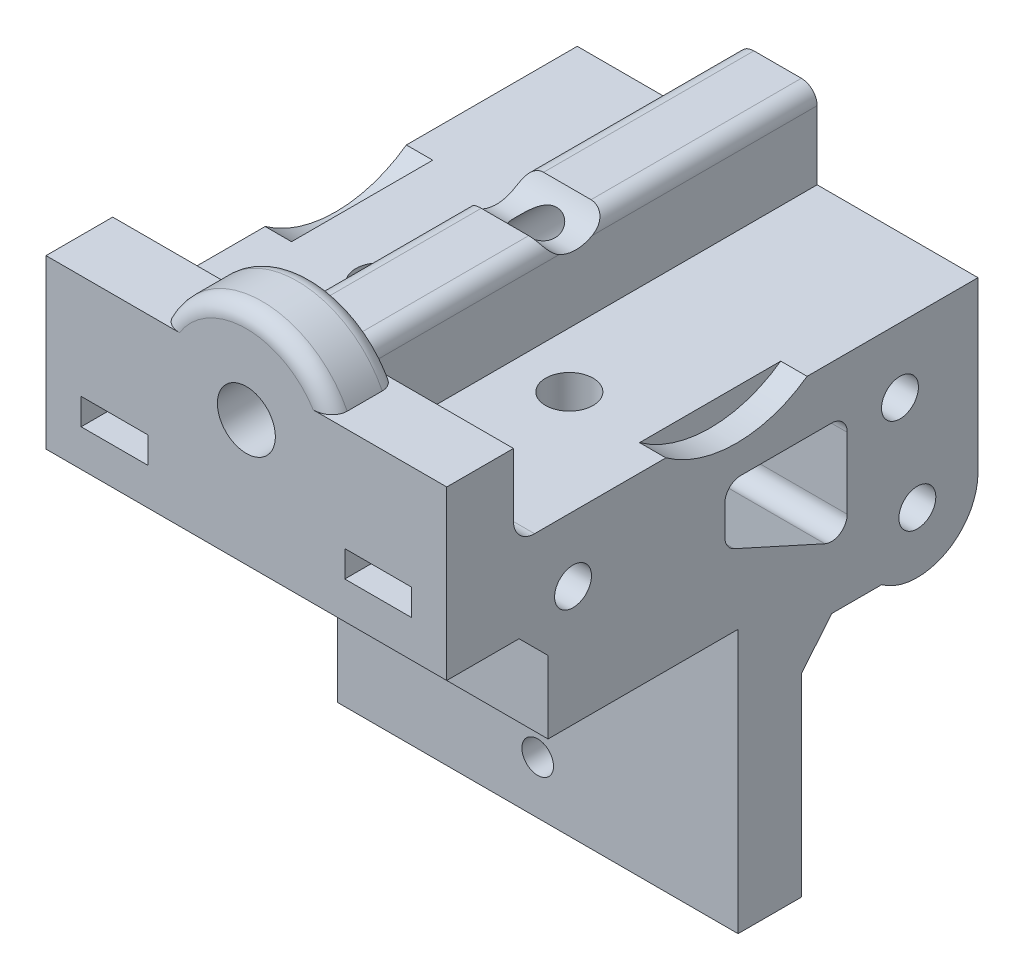
from build123d import *

# Parameters (mm, degrees)
BOSS_EXTRUDE5_DEPTH = 19
BOSS_EXTRUDE6_DEPTH = 8
BOSS_EXTRUDE7_DEPTH = 6.325904881
SKETCH11_R          = 1.75
CUT_MOTOR_DEPTH     = 19
SKETCH12_R          = 1.5
CUT_EXTRUDE7_DEPTH  = 46.325937613
SKETCH13_R          = 2.25
CUT_EXTRUDE8_DEPTH  = 46.216453805
SKETCH14_R          = 5.5
CUT_EXTRUDE9_DEPTH  = 4
SKETCH16_R          = 11.5
CUT_MOTOR_L_DEPTH   = 2.5
CUT_MOTOR_R_START   = -2.5
SKETCH15_R          = 11.5
CUT_MOTOR_R_DEPTH   = 2.5
SKETCH19_R          = 3.25
CUT_EXTRUDE10_DEPTH = 8
SKETCH20_R          = 2.75
CUT_EXTRUDE11_DEPTH = 62.878766896
CUT_EXTRUDE12_DEPTH = 56.924303306
FILLET1_R           = 2
FILLET2_R           = 1.5
FILLET3_R           = 1.5
SKETCH24_R          = 1.75
CUT_EXTRUDE14_DEPTH = 6
CUT_EXTRUDE15_DEPTH = 2.5


with BuildPart() as part:
    # Sketch10 → Boss-Extrude5 (new, symmetric)
    with BuildSketch(Plane(origin=(0, 0, 0), x_dir=(0, 0, -1), z_dir=(1, 0, 0))):
        with BuildLine():
            Line((-27.445904881, 9.607875665), (-20.588029216, 9.607875665))
            Line((-20.588029216, 9.607875665), (-17.838029216, 6.857875665))
            Line((-17.838029216, 6.857875665), (-17.838029216, 0))
            Line((-17.838029216, 0), (0.18, 0))
            Line((0.18, 0), (0.18, -25))
            Line((0.18, -25), (6.18, -25))
            Line((6.18, -25), (6.18, -6.648603252))
            Line((6.18, -6.648603252), (9.067622319, -3.148603252))
            Line((9.067622319, -3.148603252), (13.795773677, -3.148603252))
            ThreePointArc((13.795773677, -3.148603252), (19.7879876, -3.62453907), (22.93, 1.5))
            Line((22.93, 1.5), (22.93, 17.5))
            Line((22.93, 17.5), (-21.12, 17.5))
            Line((-21.12, 17.5), (-21.12, 25.5))
            Line((-21.12, 25.5), (-27.445904881, 25.5))
            Line((-27.445904881, 25.5), (-27.445904881, 9.607875665))
        make_face()
    extrude(amount=BOSS_EXTRUDE5_DEPTH, both=True)

    # Sketch18 → Boss-Extrude6 (add)
    with BuildSketch(Plane(origin=(0, 17.5, 0), x_dir=(1, 0, 0), z_dir=(0, 1, 0))):
        Polygon((-3.75, 22.93), (3.75, 22.93), (3.75, -21.12), (-3.75, -21.12), (-3.75, 14.93), align=None)
    extrude(amount=BOSS_EXTRUDE6_DEPTH)

    # Sketch21 → Boss-Extrude7 (add)
    with BuildSketch(Plane(origin=(0, 0, 27.445904881), x_dir=(-1, 0, 0), z_dir=(0, 0, -1))):
        with BuildLine():
            Line((8.062257748, 25.5), (-8.062257748, 25.5))
            ThreePointArc((-8.062257748, 25.5), (0, 30.5), (8.062257748, 25.5))
        make_face()
    extrude(amount=BOSS_EXTRUDE7_DEPTH)

    # Sketch11 → Cut-Motor (cut, symmetric)
    with BuildSketch(Plane(origin=(0, 0, 0), x_dir=(0, 0, -1), z_dir=(1, 0, 0))):
        with Locations((-15.47, 11.35)):
            Circle(SKETCH11_R)
        with Locations((15.53, 11.35)):
            Circle(SKETCH11_R)
        with Locations((17.18, 1.5)):
            Circle(SKETCH11_R)
    extrude(amount=CUT_MOTOR_DEPTH, both=True, mode=Mode.SUBTRACT)

    # Sketch12 → Cut-Extrude7 (cut, through all)
    with BuildSketch(Plane.XY.offset(-0.18)):
        with Locations((0, -20)):
            Circle(SKETCH12_R)
        with Locations((4.5, -10)):
            Circle(SKETCH12_R)
        with Locations((-4.5, -10)):
            Circle(SKETCH12_R)
    extrude(amount=-CUT_EXTRUDE7_DEPTH, mode=Mode.SUBTRACT)

    # Sketch13 → Cut-Extrude8 (cut, through all)
    with BuildSketch(Plane.XZ):
        with Locations(Location((-9, 5.82, 0), (0, 0, 270))):
            Circle(SKETCH13_R)
        with Locations(Location((9, 5.82, 0), (0, 0, 270))):
            Circle(SKETCH13_R)
    extrude(amount=-CUT_EXTRUDE8_DEPTH, mode=Mode.SUBTRACT)

    # Sketch14 → Cut-Extrude9 (cut)
    with BuildSketch(Plane.XZ):
        with Locations(Location((9, 5.82, 0), (0, 0, 270))):
            Circle(SKETCH14_R)
        with Locations(Location((-9, 5.82, 0), (0, 0, 270))):
            Circle(SKETCH14_R)
    extrude(amount=-CUT_EXTRUDE9_DEPTH, mode=Mode.SUBTRACT)

    # Sketch16 → Cut-Motor-L (cut)
    with BuildSketch(Plane.ZY.offset(19)):
        with Locations((-0.03, 26.85)):
            Circle(SKETCH16_R)
    extrude(amount=-CUT_MOTOR_L_DEPTH, mode=Mode.SUBTRACT)

    # Sketch15 → Cut-Motor-R (cut)
    with BuildSketch(Plane(origin=(19, 0, 0), x_dir=(0, 0, -1), z_dir=(1, 0, 0)).offset(CUT_MOTOR_R_START)):
        with Locations((0.03, 26.85)):
            Circle(SKETCH15_R)
    extrude(amount=CUT_MOTOR_R_DEPTH, mode=Mode.SUBTRACT)

    # Sketch19 → Cut-Extrude10 (cut)
    with BuildSketch(Plane(origin=(3.75, 0, 0), x_dir=(0, 0, -1), z_dir=(1, 0, 0))):
        with Locations((0.03, 26.85)):
            Circle(SKETCH19_R)
    extrude(amount=-CUT_EXTRUDE10_DEPTH, mode=Mode.SUBTRACT)

    # Sketch20 → Cut-Extrude11 (cut, through all)
    with BuildSketch(Plane.XY.offset(-22.93)):
        with Locations((0, 21.5)):
            Circle(SKETCH20_R)
    extrude(amount=CUT_EXTRUDE11_DEPTH, mode=Mode.SUBTRACT)

    # Sketch22 → Cut-Extrude12 (cut, through all)
    with BuildSketch(Plane(origin=(19, 0, 0), x_dir=(0, 0, -1), z_dir=(1, 0, 0))):
        with BuildLine():
            Line((-0.188639117, 6.801063089), (8.411360883, 2.907650311))
            ThreePointArc((8.411360883, 2.907650311), (9.843031772, 3.013589679), (10.53, 4.274136916))
            Line((10.53, 4.274136916), (10.53, 11))
            ThreePointArc((10.53, 11), (10.090660172, 12.060660172), (9.03, 12.5))
            Line((9.03, 12.5), (0.43, 12.5))
            ThreePointArc((0.43, 12.5), (-0.630660172, 12.060660172), (-1.07, 11))
            Line((-1.07, 11), (-1.07, 8.167549694))
            ThreePointArc((-1.07, 8.167549694), (-0.830547238, 7.354517922), (-0.188639117, 6.801063089))
        make_face()
    extrude(amount=-CUT_EXTRUDE12_DEPTH, mode=Mode.SUBTRACT)

    # Fillet1
    fillet1_edges = [part.edges().sort_by_distance(p)[0] for p in [
        (11.375, 17.5, 21.12),
        (-11.375, 17.5, 21.12),
    ]]
    fillet(fillet1_edges, radius=FILLET1_R)

    # Fillet2
    fillet2_edges = [part.edges().sort_by_distance(p)[0] for p in [
        (0, 30.5, 21.12),
        (0, 30.5, 27.445904881),
    ]]
    fillet(fillet2_edges, radius=FILLET2_R)

    # Fillet3
    fillet3_edges = [part.edges().sort_by_distance(p)[0] for p in [
        (3.75, 25.5, -12.95817455),
        (-3.75, 25.5, 12.02317455),
        (-3.75, 25.5, -12.95817455),
        (3.75, 25.5, 12.02317455),
    ]]
    fillet(fillet3_edges, radius=FILLET3_R)

    # Sketch24 → Cut-Extrude14 (cut)
    with BuildSketch(Plane.XZ.offset(-9.607875665)):
        with Locations(Location((-12.5, 22.445904881, 0), (0, 0, 270))):
            Circle(SKETCH24_R)
        with Locations(Location((12.5, 22.445904881, 0), (0, 0, 270))):
            Circle(SKETCH24_R)
    extrude(amount=-CUT_EXTRUDE14_DEPTH, mode=Mode.SUBTRACT)

    # Sketch25 → Cut-Extrude15 (cut)
    with BuildSketch(Plane.XZ.offset(-15.607875665)):
        Polygon((-15.667914761, 27.445904881), (-9.332085239, 27.445904881), (-9.332085239, 20.616908441), (-12.5, 18.787912001), (-15.667914761, 20.616908441), align=None)
        Polygon((9.332085239, 27.445904881), (15.667914761, 27.445904881), (15.667914761, 20.616908441), (12.5, 18.787912001), (9.332085239, 20.616908441), align=None)
    extrude(amount=CUT_EXTRUDE15_DEPTH, mode=Mode.SUBTRACT)


solid = part.part
